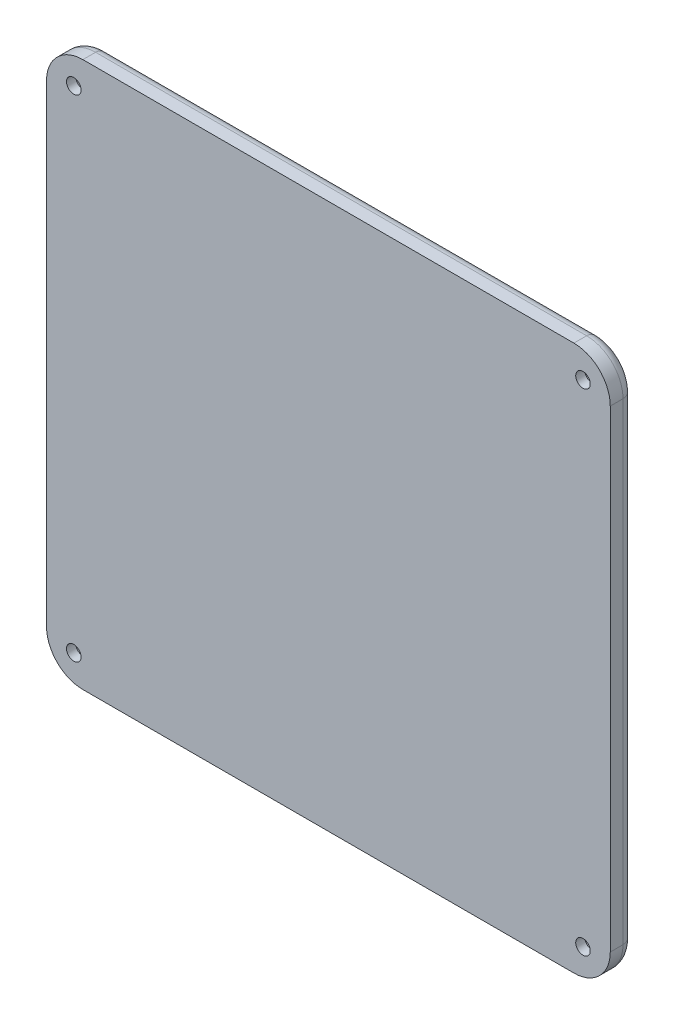
from build123d import *

# Parameters (mm, degrees)
SKETCH1_R           = 1.25
BOSS_EXTRUDE1_DEPTH = 6.5
SKETCH2_R           = 2
CUT_EXTRUDE1_DEPTH  = 334.604931019
FILLET1_R           = 3
SKETCH3_R           = 4
CUT_EXTRUDE2_DEPTH  = 4


with BuildPart() as part:
    # Sketch1 → Boss-Extrude1 (new body)
    with BuildSketch(Plane.XY):
        with BuildLine():
            Line((-315, -75), (-180, -75))
            ThreePointArc((-180, -75), (-172.928932188, -72.071067812), (-170, -65))
            Line((-170, -65), (-170, 65))
            ThreePointArc((-170, 65), (-172.928932188, 72.071067812), (-180, 75))
            Line((-180, 75), (-315, 75))
            ThreePointArc((-315, 75), (-322.071067812, 72.071067812), (-325, 65))
            Line((-325, 65), (-325, -65))
            ThreePointArc((-325, -65), (-322.071067812, -72.071067812), (-315, -75))
        make_face()
        with Locations(Location((-317.5, -67.5, 0), (0, 0, 180))):
            Circle(SKETCH1_R, mode=Mode.SUBTRACT)
        with Locations(Location((-177.5, -67.5, 0), (0, 0, 180))):
            Circle(SKETCH1_R, mode=Mode.SUBTRACT)
        with Locations(Location((-177.5, 67.5, 0), (0, 0, 180))):
            Circle(SKETCH1_R, mode=Mode.SUBTRACT)
        with Locations(Location((-317.5, 67.5, 0), (0, 0, 180))):
            Circle(SKETCH1_R, mode=Mode.SUBTRACT)
    extrude(amount=BOSS_EXTRUDE1_DEPTH)

    # Sketch2 → Cut-Extrude1 (cut, through all)
    with BuildSketch(Plane(origin=(0, 0, 0), x_dir=(-1, 0, 0), z_dir=(0, 0, -1))):
        with Locations((177.5, 67.5)):
            Circle(SKETCH2_R)
        with Locations((317.5, 67.5)):
            Circle(SKETCH2_R)
        with Locations((317.5, -67.5)):
            Circle(SKETCH2_R)
        with Locations((177.5, -67.5)):
            Circle(SKETCH2_R)
    extrude(amount=-CUT_EXTRUDE1_DEPTH, mode=Mode.SUBTRACT)

    # Fillet1
    fillet1_edges = [part.edges().sort_by_distance(p)[0] for p in [
        (-170, 0, 0),
        (-172.928932188, -72.071067812, 0),
        (-247.5, -75, 0),
        (-322.071067812, -72.071067812, 0),
        (-325, 0, 0),
        (-322.071067812, 72.071067812, 0),
        (-247.5, 75, 0),
        (-172.928932188, 72.071067812, 0),
    ]]
    fillet(fillet1_edges, radius=FILLET1_R)

    # Sketch3 → Cut-Extrude2 (cut)
    with BuildSketch(Plane(origin=(0, 0, 0), x_dir=(-1, 0, 0), z_dir=(0, 0, -1))):
        with Locations((177.5, 67.5)):
            Circle(SKETCH3_R)
        with Locations((317.5, 67.5)):
            Circle(SKETCH3_R)
        with Locations((177.5, -67.5)):
            Circle(SKETCH3_R)
        with Locations((317.5, -67.5)):
            Circle(SKETCH3_R)
    extrude(amount=-CUT_EXTRUDE2_DEPTH, mode=Mode.SUBTRACT)


solid = part.part
